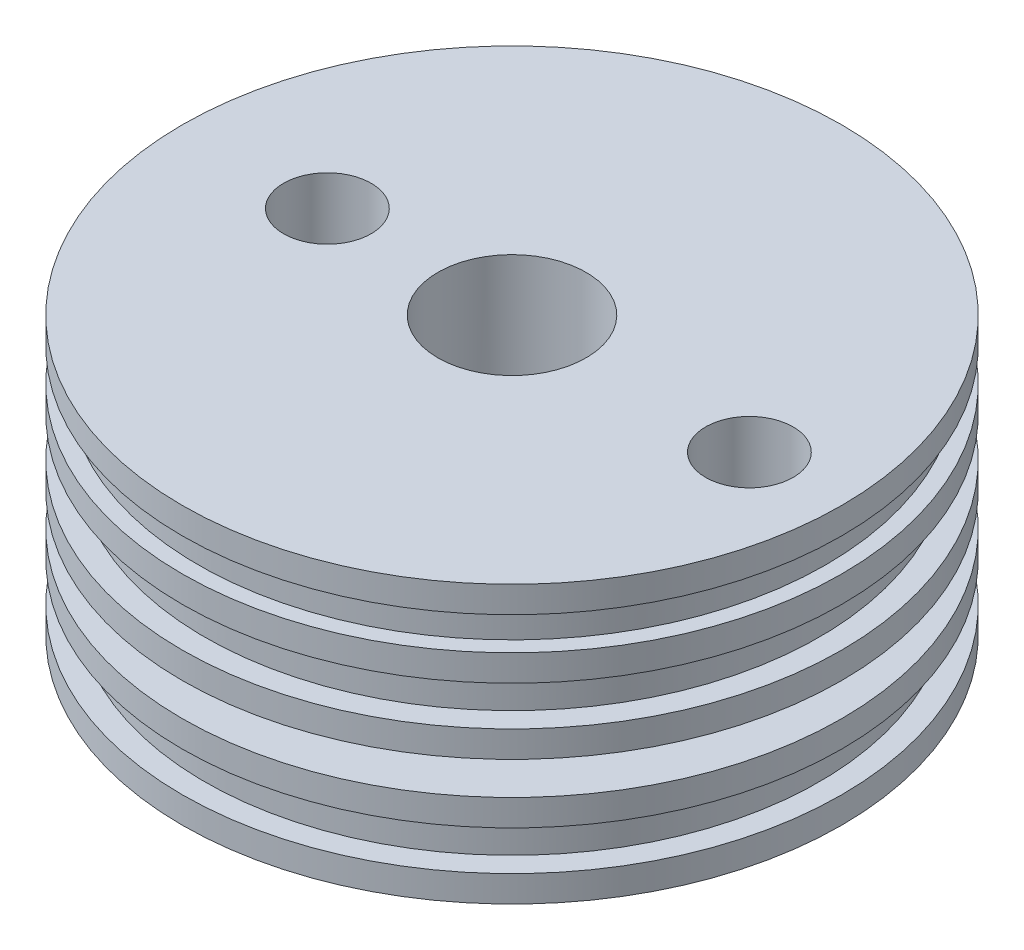
from build123d import *

# Parameters (mm, degrees)
PIPE_TAP_DRILL_FOR_1_8_TAP1_D      = 8.4328
PIPE_TAP_DRILL_FOR_1_8_TAP1_DEPTH  = 15.246531286
PIPE_TAP_DRILL_FOR_1_8_TAP1_TIP    = 2.533468714
PIPE_TAP_DRILL_FOR_3_8_TAP2_D      = 14.2748
PIPE_TAP_DRILL_FOR_3_8_TAP2_DEPTH  = 12.7
PIPE_TAP_DRILL_FOR_3_8_TAP2_TIP    = 4.288582582
CIRPATTERN4_COUNT                  = 3
PIPE_TAP_DRILL_FOR_1_8_TAP2_D      = 8.4328
PIPE_TAP_DRILL_FOR_1_8_TAP2_DEPTH  = 10.166531286
PIPE_TAP_DRILL_FOR_1_8_TAP2_TIP    = 2.533468714
F_1_16_0_0625_DIAMETER_HOLE1_D     = 1.5875
F_1_16_0_0625_DIAMETER_HOLE1_DEPTH = 8.89
F_1_4_20_TAPPED_HOLE1_D            = 5.1054
F_1_4_20_TAPPED_HOLE1_DEPTH        = 11.166183098
F_1_4_20_TAPPED_HOLE1_TIP          = 1.533816902
F_29_0_136_DIAMETER_HOLE4_D        = 3.4544
F_29_0_136_DIAMETER_HOLE4_DEPTH    = 17.78
F_29_0_136_DIAMETER_HOLE4_TIP      = 1.037806461
CIRPATTERN3_COUNT                  = 3


with BuildPart() as part:
    # Sketch1 → Revolve1 (revolve)
    with BuildSketch(Plane.XY):
        Polygon((-31.75, 12.7), (-29.591, 12.7), (-29.591, 8.89), (-31.75, 8.89), (-31.75, 6.35), (-19.05, 6.35), (-19.05, 3.175), (-31.75, 3.175), (-31.75, 0.635), (-29.591, 0.635), (-29.591, -3.175), (-31.75, -3.175), (-31.75, -5.715), (-25.4, -5.715), (-25.4, 0), (0, 0), (0, 20.955), (-31.75, 20.955), (-31.75, 18.415), (-30.226, 18.415), (-30.226, 15.24), (-31.75, 15.24), align=None)
    revolve(axis=Axis((0, 26.246011395, 0), (0, -1, 0)))

    # Pipe Tap Drill for 1/8 Tap1
    with Locations(Plane(origin=(0, 20.955, 0), x_dir=(1, 0, 0), z_dir=(0, 1, 0))):
        with Locations((22.86, 0)):
            Hole(PIPE_TAP_DRILL_FOR_1_8_TAP1_D / 2, depth=PIPE_TAP_DRILL_FOR_1_8_TAP1_DEPTH)
            with Locations((0, 0, -(PIPE_TAP_DRILL_FOR_1_8_TAP1_DEPTH + PIPE_TAP_DRILL_FOR_1_8_TAP1_TIP / 2))):  # 118° drill point
                Cone(0, PIPE_TAP_DRILL_FOR_1_8_TAP1_D / 2, PIPE_TAP_DRILL_FOR_1_8_TAP1_TIP, mode=Mode.SUBTRACT)

    # Pipe Tap Drill for 3/8 Tap2
    with Locations(Plane(origin=(0, 20.955, 0), x_dir=(1, 0, 0), z_dir=(0, 1, 0))):
        with Locations((0, 0)):
            Hole(PIPE_TAP_DRILL_FOR_3_8_TAP2_D / 2, depth=PIPE_TAP_DRILL_FOR_3_8_TAP2_DEPTH)
            with Locations((0, 0, -(PIPE_TAP_DRILL_FOR_3_8_TAP2_DEPTH + PIPE_TAP_DRILL_FOR_3_8_TAP2_TIP / 2))):  # 118° drill point
                Cone(0, PIPE_TAP_DRILL_FOR_3_8_TAP2_D / 2, PIPE_TAP_DRILL_FOR_3_8_TAP2_TIP, mode=Mode.SUBTRACT)

    # Sketch7 → #39 (0.0995) Diameter Hole1 (revolve, cut)
    with BuildSketch(Plane(origin=(5.499261314, 0, 3.175), x_dir=(0, 0, -1), z_dir=(1, 0, 0))):
        Polygon((0, 0), (0, 11.176), (1.26365, 10.416722479), (1.26365, 0), align=None)
    f_39_0_0995_diameter_hole1 = revolve(axis=Axis((5.499261314, -6.35, 3.175), (0, 1, 0)), mode=Mode.SUBTRACT)

    # CirPattern4: #39 (0.0995) Diameter Hole1 ×3 about axis
    cirpattern4_axis = Axis((0, 0, 0), (0, 1, 0))
    for i in range(1, CIRPATTERN4_COUNT):
        add(f_39_0_0995_diameter_hole1.rotate(cirpattern4_axis, i * 360 / CIRPATTERN4_COUNT), mode=Mode.SUBTRACT)

    # Pipe Tap Drill for 1/8 Tap2
    with Locations(Plane(origin=(0, 20.955, 0), x_dir=(1, 0, 0), z_dir=(0, 1, 0))):
        with Locations((-17.78, 0)):
            Hole(PIPE_TAP_DRILL_FOR_1_8_TAP2_D / 2, depth=PIPE_TAP_DRILL_FOR_1_8_TAP2_DEPTH)
            with Locations((0, 0, -(PIPE_TAP_DRILL_FOR_1_8_TAP2_DEPTH + PIPE_TAP_DRILL_FOR_1_8_TAP2_TIP / 2))):  # 118° drill point
                Cone(0, PIPE_TAP_DRILL_FOR_1_8_TAP2_D / 2, PIPE_TAP_DRILL_FOR_1_8_TAP2_TIP, mode=Mode.SUBTRACT)

    # 1/16 (0.0625) Diameter Hole1
    with Locations(Plane(origin=(0, -5.715, 0), x_dir=(-1, 0, 0), z_dir=(0, -1, 0))):
        with Locations((-17.597636205, -10.16)):
            f_1_16_0_0625_diameter_hole1 = Hole(F_1_16_0_0625_DIAMETER_HOLE1_D / 2, depth=F_1_16_0_0625_DIAMETER_HOLE1_DEPTH)

    # 1/4-20 Tapped Hole1
    with Locations(Plane(origin=(0, 0, 0), x_dir=(-1, 0, 0), z_dir=(0, -1, 0))):
        with Locations((0, 0)):
            Hole(F_1_4_20_TAPPED_HOLE1_D / 2, depth=F_1_4_20_TAPPED_HOLE1_DEPTH)
            with Locations((0, 0, -(F_1_4_20_TAPPED_HOLE1_DEPTH + F_1_4_20_TAPPED_HOLE1_TIP / 2))):  # 118° drill point
                Cone(0, F_1_4_20_TAPPED_HOLE1_D / 2, F_1_4_20_TAPPED_HOLE1_TIP, mode=Mode.SUBTRACT)

    # #29 (0.136) Diameter Hole4
    with Locations(Plane(origin=(0, -5.715, 0), x_dir=(-1, 0, 0), z_dir=(0, -1, 0))):
        with Locations((15.24, 0)):
            Hole(F_29_0_136_DIAMETER_HOLE4_D / 2, depth=F_29_0_136_DIAMETER_HOLE4_DEPTH)
            with Locations((0, 0, -(F_29_0_136_DIAMETER_HOLE4_DEPTH + F_29_0_136_DIAMETER_HOLE4_TIP / 2))):  # 118° drill point
                Cone(0, F_29_0_136_DIAMETER_HOLE4_D / 2, F_29_0_136_DIAMETER_HOLE4_TIP, mode=Mode.SUBTRACT)

    # CirPattern3: 1/16 (0.0625) Diameter Hole1 ×3 about axis
    cirpattern3_axis = Axis((0, 0, 0), (0, 1, 0))
    for i in range(1, CIRPATTERN3_COUNT):
        add(f_1_16_0_0625_diameter_hole1.rotate(cirpattern3_axis, i * 360 / CIRPATTERN3_COUNT), mode=Mode.SUBTRACT)


solid = part.part
